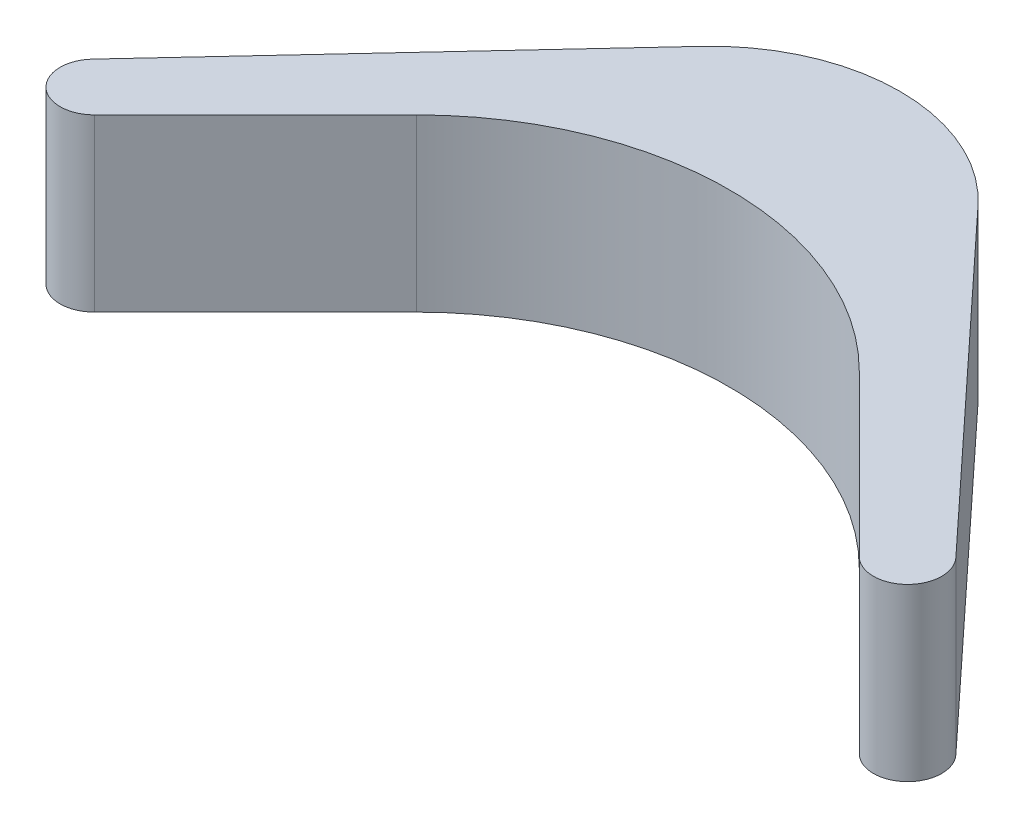
from build123d import *

# Parameters (mm, degrees)
BOSS_EXTRUDE1_DEPTH = 15


with BuildPart() as part:
    # Sketch1 → Boss-Extrude1 (new body)
    with BuildSketch(Plane(origin=(0, 0, 0), x_dir=(1, 0, 0), z_dir=(0, 1, 0))):
        with BuildLine():
            Line((-19.445436483, 19.445436483), (-33.587572106, 5.303300859))
            ThreePointArc((-33.587572106, 5.303300859), (-37.791344866, 5.265132389), (-37.90583769, 9.467519049))
            Line((-37.90583769, 9.467519049), (-12.131921555, 37.184951157))
            ThreePointArc((-12.131921555, 37.184951157), (0, 42.470239124), (12.131921555, 37.184951157))
            Line((12.131921555, 37.184951157), (37.90583769, 9.467519049))
            ThreePointArc((37.90583769, 9.467519049), (37.791344866, 5.265132389), (33.587572106, 5.303300859))
            Line((33.587572106, 5.303300859), (19.445436483, 19.445436483))
            ThreePointArc((19.445436483, 19.445436483), (0, 27.5), (-19.445436483, 19.445436483))
        make_face()
    extrude(amount=BOSS_EXTRUDE1_DEPTH)


solid = part.part
